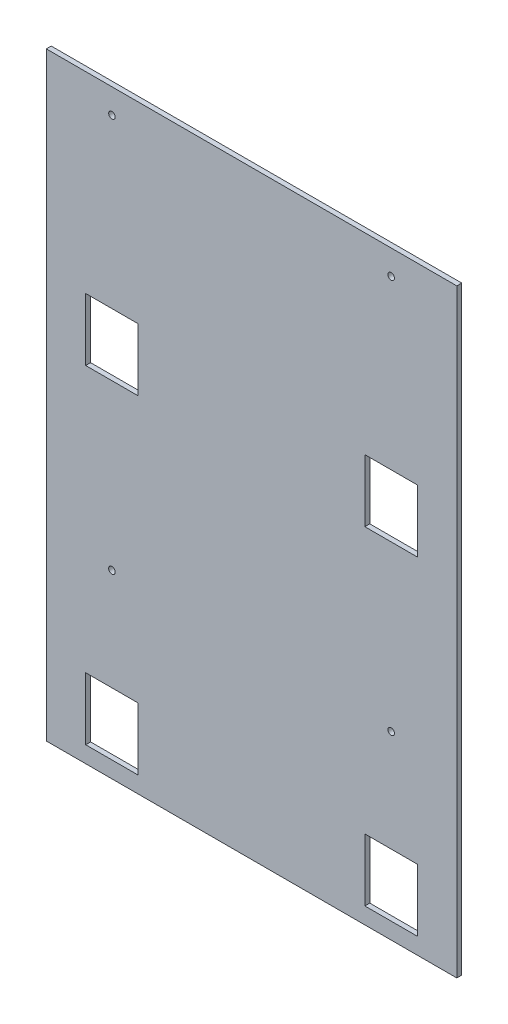
from build123d import *

# Parameters (mm, degrees)
SKETCH1_W           = 250
SKETCH1_H           = 365
BOSS_EXTRUDE1_DEPTH = 3
SKETCH3_R           = 2
CUT_EXTRUDE2_DEPTH  = 3
SKETCH4_W           = 32
SKETCH4_H           = 38
CUT_EXTRUDE3_DEPTH  = 10


with BuildPart() as part:
    # Sketch1 → Boss-Extrude1 (new body)
    with BuildSketch(Plane.XY):
        Rectangle(SKETCH1_W, SKETCH1_H)
    extrude(amount=BOSS_EXTRUDE1_DEPTH)

    # Sketch3 → Cut-Extrude2 (cut)
    with BuildSketch(Plane.XY.offset(3)):
        with Locations((-85, 167.5)):
            Circle(SKETCH3_R)
        with Locations((-85, 47.5)):
            Circle(SKETCH3_R)
        with Locations((-85, -72.5)):
            Circle(SKETCH3_R)
        with Locations((-85, -192.5)):
            Circle(SKETCH3_R)
        with Locations((85, -192.5)):
            Circle(SKETCH3_R)
        with Locations(Location((85, -72.5, 0), (0, 0, 180))):
            Circle(SKETCH3_R)
        with Locations(Location((85, 47.5, 0), (0, 0, 180))):
            Circle(SKETCH3_R)
        with Locations(Location((85, 167.5, 0), (0, 0, 180))):
            Circle(SKETCH3_R)
    extrude(amount=-CUT_EXTRUDE2_DEPTH, mode=Mode.SUBTRACT)

    # Sketch4 → Cut-Extrude3 (cut)
    with BuildSketch(Plane(origin=(0, 0, 0), x_dir=(-1, 0, 0), z_dir=(0, 0, -1))):
        with Locations((-85, -153.5)):
            Rectangle(SKETCH4_W, SKETCH4_H)
        with Locations((85, -153.5)):
            Rectangle(SKETCH4_W, SKETCH4_H)
        with Locations((-85, 46.5)):
            Rectangle(SKETCH4_W, SKETCH4_H)
        with Locations((85, 46.5)):
            Rectangle(SKETCH4_W, SKETCH4_H)
    extrude(amount=-CUT_EXTRUDE3_DEPTH, mode=Mode.SUBTRACT)


solid = part.part
